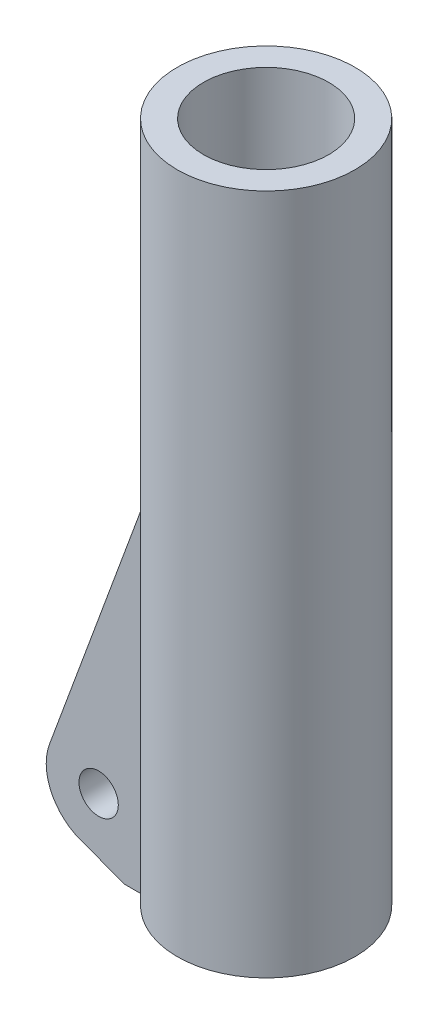
from build123d import *

# Parameters (mm, degrees)
SKETCH1_R           = 43.053
SKETCH1_R_2         = 30.353
BOSS_EXTRUDE1_DEPTH = 165.1
SKETCH2_R           = 9.525
BOSS_EXTRUDE2_DEPTH = 25.4


with BuildPart() as part:
    # Sketch1 → Boss-Extrude1 (new, symmetric)
    with BuildSketch(Plane(origin=(0, 0, 0), x_dir=(1, 0, 0), z_dir=(0, 1, 0))):
        with Locations(Location((0, 0, 0), (0, 0, 270))):
            Circle(SKETCH1_R)
        with Locations(Location((0, 0, 0), (0, 0, 270))):
            Circle(SKETCH1_R_2, mode=Mode.SUBTRACT)
    extrude(amount=BOSS_EXTRUDE1_DEPTH, both=True)

    # Sketch2 → Boss-Extrude2 (add, symmetric)
    with BuildSketch(Plane.XY):
        with BuildLine():
            Line((-64.535931448, -157.183172579), (-43.053, -165.1))
            Line((-43.053, -165.1), (-30.353, -165.1))
            Line((-30.353, -165.1), (-30.353, 9.031002397))
            Line((-30.353, 9.031002397), (-79.586172579, -124.567068552))
            ThreePointArc((-79.586172579, -124.567068552), (-78.816068333, -143.992127562), (-64.535931448, -157.183172579))
        make_face()
        with Locations((-55.753, -133.35)):
            Circle(SKETCH2_R, mode=Mode.SUBTRACT)
    extrude(amount=BOSS_EXTRUDE2_DEPTH, both=True)


solid = part.part
